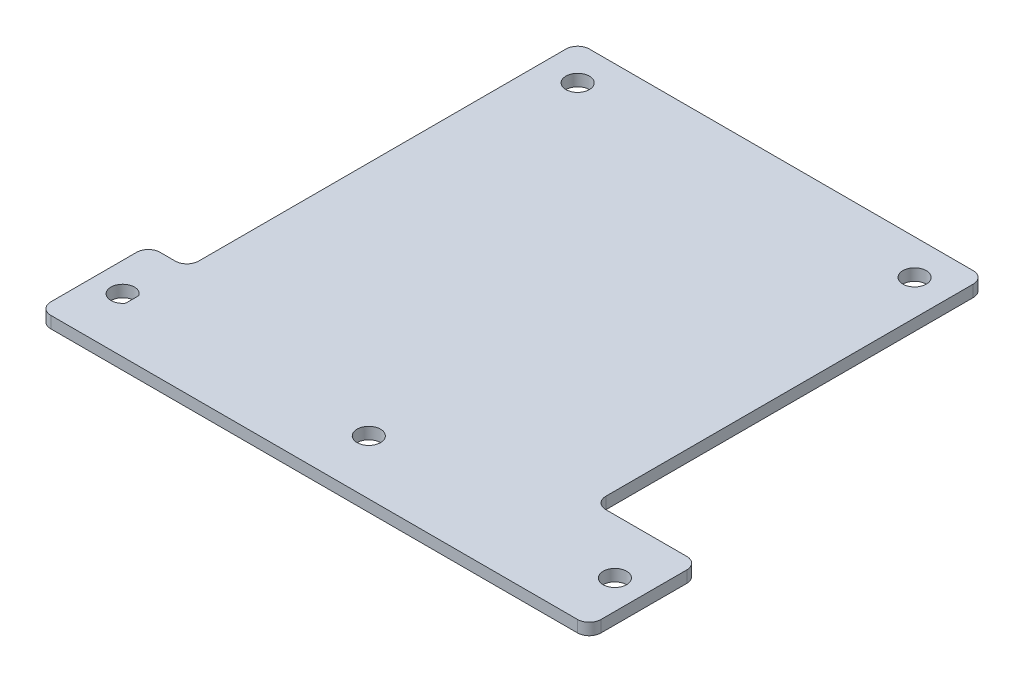
from build123d import *

# Parameters (mm, degrees)
SKETCH1_W           = 69.5
SKETCH1_H           = 82
BOSS_EXTRUDE1_DEPTH = 2
BOSS_EXTRUDE3_START = -2
BOSS_EXTRUDE3_DEPTH = 2
FILLET1_R           = 2


with BuildPart() as part:
    # Sketch1 → Boss-Extrude1 (new body)
    # profile 1 of 2: a face of its own
    with BuildSketch(Plane(origin=(0, 0, 0), x_dir=(1, 0, 0), z_dir=(0, 1, 0))):
        Rectangle(SKETCH1_W, SKETCH1_H)
        with BuildLine():
            ThreePointArc((7.602792708, -35), (5.602792708, -37), (3.602792708, -35))
            Line((3.602792708, -35), (-28.75, -35))
            Line((-28.75, -35), (-28.75, 33))
            ThreePointArc((-28.75, 33), (-30.164213562, 36.414213562), (-26.75, 35))
            Line((-26.75, 35), (26.75, 35))
            ThreePointArc((26.75, 35), (28.75, 37), (30.75, 35))
            ThreePointArc((30.75, 35), (30.164213562, 33.585786438), (28.75, 33))
            Line((28.75, 33), (28.75, -35))
            Line((28.75, -35), (7.602792708, -35))
        make_face(mode=Mode.SUBTRACT)
    # profile 2 of 2: a face of its own
    with BuildSketch(Plane(origin=(0, 0, 0), x_dir=(1, 0, 0), z_dir=(0, 1, 0))):
        with BuildLine():
            Line((-28.75, -35), (3.602792708, -35))
            ThreePointArc((3.602792708, -35), (5.602792708, -33), (7.602792708, -35))
            Line((7.602792708, -35), (28.75, -35))
            Line((28.75, -35), (28.75, 33))
            ThreePointArc((28.75, 33), (27.335786438, 33.585786438), (26.75, 35))
            Line((26.75, 35), (-26.75, 35))
            ThreePointArc((-26.75, 35), (-27.335786438, 33.585786438), (-28.75, 33))
            Line((-28.75, 33), (-28.75, -35))
        make_face()
    extrude(amount=BOSS_EXTRUDE1_DEPTH)

    # Sketch2 → Boss-Extrude3 (add)
    with BuildSketch(Plane(origin=(0, 2, 0), x_dir=(1, 0, 0), z_dir=(0, 1, 0)).offset(BOSS_EXTRUDE3_START)):
        with BuildLine():
            Line((47.602792708, -40.964572004), (34.75, -40.964572004))
            Line((34.75, -40.964572004), (34.75, -41))
            Line((34.75, -41), (-34.75, -41))
            Line((-34.75, -41), (-34.75, -40.964572004))
            Line((-34.75, -40.964572004), (-36.397207292, -40.964572004))
            Line((-36.397207292, -40.964572004), (-36.397207292, -37))
            ThreePointArc((-36.397207292, -37), (-38.397207292, -35), (-36.397207292, -33))
            Line((-36.397207292, -33), (-36.397207292, -29.035427996))
            Line((-36.397207292, -29.035427996), (-34.75, -29.035427996))
            Line((-34.75, -29.035427996), (-34.75, -25.680337555))
            Line((-34.75, -25.680337555), (-41.343372537, -25.680337555))
            Line((-41.343372537, -25.680337555), (-41.343372537, -44.319662445))
            Line((-41.343372537, -44.319662445), (52.548957953, -44.319662445))
            Line((52.548957953, -44.319662445), (52.548957953, -25.680337555))
            Line((52.548957953, -25.680337555), (34.75, -25.680337555))
            Line((34.75, -25.680337555), (34.75, -29.035427996))
            Line((34.75, -29.035427996), (47.602792708, -29.035427996))
            Line((47.602792708, -29.035427996), (47.602792708, -33))
            ThreePointArc((47.602792708, -33), (49.01700627, -33.585786438), (49.602792708, -35))
            ThreePointArc((49.602792708, -35), (49.01700627, -36.414213562), (47.602792708, -37))
            Line((47.602792708, -37), (47.602792708, -40.964572004))
        make_face()
        with BuildLine():
            ThreePointArc((7.602792708, -35), (5.602792708, -37), (3.602792708, -35))
            Line((3.602792708, -35), (-34.397207292, -35))
            ThreePointArc((-34.397207292, -35), (-34.487441, -35.593963558), (-34.75, -36.134331582))
            Line((-34.75, -36.134331582), (-34.75, -40.964572004))
            Line((-34.75, -40.964572004), (34.75, -40.964572004))
            Line((34.75, -40.964572004), (34.75, -35))
            Line((34.75, -35), (7.602792708, -35))
        make_face()
        with BuildLine():
            Line((-34.397207292, -35), (3.602792708, -35))
            ThreePointArc((3.602792708, -35), (5.602792708, -33), (7.602792708, -35))
            Line((7.602792708, -35), (34.75, -35))
            Line((34.75, -35), (34.75, -29.035427996))
            Line((34.75, -29.035427996), (-34.75, -29.035427996))
            Line((-34.75, -29.035427996), (-34.75, -33.865668418))
            ThreePointArc((-34.75, -33.865668418), (-34.487441, -34.406036442), (-34.397207292, -35))
        make_face()
        with BuildLine():
            Line((45.602792708, -35), (34.75, -35))
            Line((34.75, -35), (34.75, -40.964572004))
            Line((34.75, -40.964572004), (47.602792708, -40.964572004))
            Line((47.602792708, -40.964572004), (47.602792708, -37))
            ThreePointArc((47.602792708, -37), (46.188579146, -36.414213562), (45.602792708, -35))
        make_face()
        with BuildLine():
            Line((34.75, -29.035427996), (34.75, -35))
            Line((34.75, -35), (45.602792708, -35))
            ThreePointArc((45.602792708, -35), (46.188579146, -33.585786438), (47.602792708, -33))
            Line((47.602792708, -33), (47.602792708, -29.035427996))
            Line((47.602792708, -29.035427996), (34.75, -29.035427996))
        make_face()
        with BuildLine():
            Line((-34.75, -40.964572004), (-34.75, -36.134331582))
            ThreePointArc((-34.75, -36.134331582), (-35.466794256, -36.770404355), (-36.397207292, -37))
            Line((-36.397207292, -37), (-36.397207292, -40.964572004))
            Line((-36.397207292, -40.964572004), (-34.75, -40.964572004))
        make_face()
        with BuildLine():
            ThreePointArc((-36.397207292, -33), (-35.466794256, -33.229595645), (-34.75, -33.865668418))
            Line((-34.75, -33.865668418), (-34.75, -29.035427996))
            Line((-34.75, -29.035427996), (-36.397207292, -29.035427996))
            Line((-36.397207292, -29.035427996), (-36.397207292, -33))
        make_face()
    extrude(amount=BOSS_EXTRUDE3_DEPTH)

    # Fillet1
    fillet1_edges = [part.edges().sort_by_distance(p)[0] for p in [
        (34.75, 1, -41),
        (-34.75, 1, -41),
        (34.75, 1, 25.680337555),
        (52.548957953, 1, 25.680337555),
        (52.548957953, 1, 44.319662445),
        (-41.343372537, 1, 44.319662445),
        (-41.343372537, 1, 25.680337555),
        (-34.75, 1, 25.680337555),
    ]]
    fillet(fillet1_edges, radius=FILLET1_R)


solid = part.part
